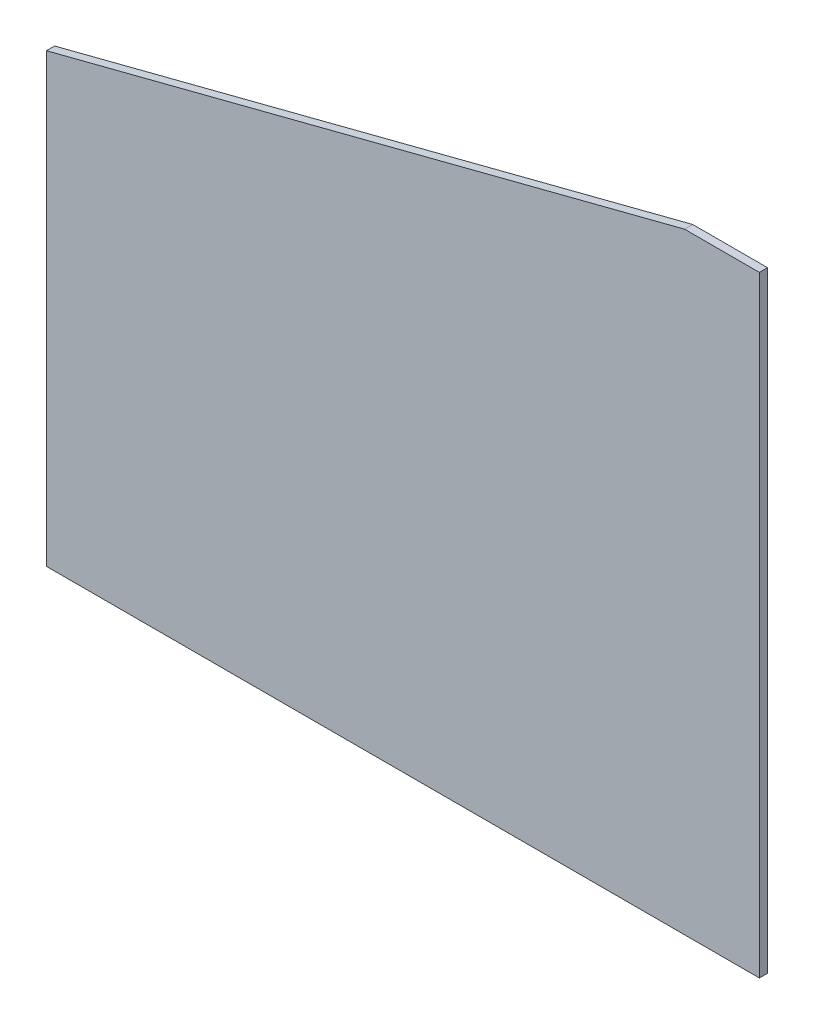
from build123d import *

# Parameters (mm, degrees)
AUFSATZ_LINEAR_AUSTRAGEN1_DEPTH = 16


with BuildPart() as part:
    # Skizze1 → Aufsatz-Linear austragen1 (new body)
    with BuildSketch(Plane.XY):
        Polygon((0, 0), (0, 877), (1252.977431987, 1200), (1400, 1200), (1400, 0), align=None)
    extrude(amount=AUFSATZ_LINEAR_AUSTRAGEN1_DEPTH)


solid = part.part
